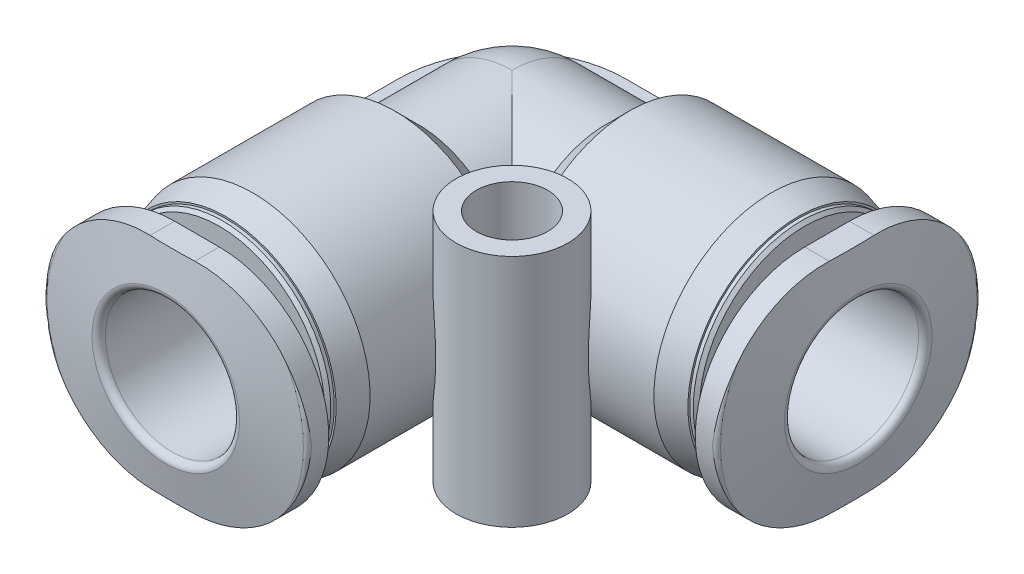
from build123d import *

# Parameters (mm, degrees)
SCHNITT_LINEAR_AUSTRAGEN1_DEPTH      = 1.4
AUFSATZ_LINEAR_START                 = 5.25
AUFSATZ_LINEAR_AUSTRAGEN1_DEPTH      = 5.25
AUFSATZ_LINEAR_AUSTRAGEN2_DEPTH      = 5.25
SCHNITT_LINEAR_AUSTRAGEN2_DEPTH      = 1.4
AUFSATZ_LINEAR_AUSTRAGEN3_DEPTH      = 5.25
AUFSATZ_LINEAR_AUSTRAGEN3_DEPTH_BACK = 5.25
SKIZZE9_R                            = 2.5
BOHRUNG1_D                           = 3.2
BOHRUNG1_DEPTH                       = 11.5
ROTATION3_ANGLE                      = 90


with BuildPart() as part:
    # Skizze1 → Rotation1 (revolve)
    with BuildSketch(Plane.XY):
        with BuildLine():
            Line((0, 4.2), (4.2, 4.2))
            Line((4.2, 4.2), (5.25, 5.25))
            Line((5.25, 5.25), (11.6, 5.25))
            Line((11.6, 5.25), (12.8, 4.928460969))
            Line((12.8, 4.928460969), (12.8, 4.848076211))
            Line((12.8, 4.848076211), (12.958578644, 4.848076211))
            Line((12.958578644, 4.848076211), (13.1, 4.706654855))
            Line((13.1, 4.706654855), (13.1, 3.7))
            Line((13.1, 3.7), (13.73, 3.7))
            ThreePointArc((13.73, 3.7), (13.991629509, 3.808370491), (14.1, 4.07))
            Line((14.1, 4.07), (14.1, 5.9))
            Line((14.1, 5.9), (14.873729924, 5.9))
            ThreePointArc((14.873729924, 5.9), (15.002287446, 5.853208889), (15.070691475, 5.734729636))
            Line((15.070691475, 5.734729636), (15.5, 3.3))
            Line((15.5, 3.3), (15.5, 0))
            Line((15.5, 0), (-4.2, 0))
            ThreePointArc((-4.2, 0), (-2.969848481, 2.969848481), (0, 4.2))
        make_face()
    revolve(axis=Axis((15.5, 0, 0), (-1, 0, 0)))

    # Skizze2 → Schnitt-Linear austragen1 (cut)
    with BuildSketch(Plane(origin=(15.5, 0, 0), x_dir=(0, 0, -1), z_dir=(1, 0, 0))):
        Polygon((-7.08, -4.087639906), (0, -8.175279812), (7.08, -4.087639906), (7.08, 4.087639906), (0, 8.175279812), (-7.08, 4.087639906), align=None)
        with BuildLine():
            Line((-1, -4.9), (1, -4.9))
            ThreePointArc((1, -4.9), (4.464823228, -3.464823228), (5.9, 0))
            ThreePointArc((5.9, 0), (4.464823228, 3.464823228), (1, 4.9))
            Line((1, 4.9), (-1, 4.9))
            ThreePointArc((-1, 4.9), (-4.464823228, 3.464823228), (-5.9, 0))
            ThreePointArc((-5.9, 0), (-4.464823228, -3.464823228), (-1, -4.9))
        make_face(mode=Mode.SUBTRACT)
    extrude(amount=-SCHNITT_LINEAR_AUSTRAGEN1_DEPTH, mode=Mode.SUBTRACT)

    # Skizze3 → Aufsatz-Linear austragen1 (add)
    with BuildSketch(Plane(origin=(0, 0, 0), x_dir=(0, 0, -1), z_dir=(1, 0, 0)).offset(AUFSATZ_LINEAR_START)):
        with BuildLine():
            Line((-5.077865912, -1.333333333), (5.077865912, -1.333333333))
            ThreePointArc((5.077865912, -1.333333333), (5.25, 0), (5.077865912, 1.333333333))
            Line((5.077865912, 1.333333333), (-5.077865912, 1.333333333))
            ThreePointArc((-5.077865912, 1.333333333), (-5.25, 0), (-5.077865912, -1.333333333))
        make_face()
    extrude(amount=-AUFSATZ_LINEAR_AUSTRAGEN1_DEPTH)

    # Skizze5 → Aufsatz-Linear austragen2 (add)
    with BuildSketch(Plane.XY):
        with BuildLine():
            Line((-5.077865912, -1.333333333), (0, -1.333333333))
            Line((0, -1.333333333), (0, 1.333333333))
            Line((0, 1.333333333), (-5.077865912, 1.333333333))
            ThreePointArc((-5.077865912, 1.333333333), (-5.25, 0), (-5.077865912, -1.333333333))
        make_face()
    extrude(amount=AUFSATZ_LINEAR_AUSTRAGEN2_DEPTH)

    # Skizze6 → Rotation2 (revolve)
    with BuildSketch(Plane(origin=(0, 0, 0), x_dir=(0, 0, -1), z_dir=(1, 0, 0))):
        with BuildLine():
            Line((0, 0), (0, -4.2))
            Line((0, -4.2), (-4.2, -4.2))
            Line((-4.2, -4.2), (-5.25, -5.25))
            Line((-5.25, -5.25), (-11.6, -5.25))
            Line((-11.6, -5.25), (-12.8, -4.928460969))
            Line((-12.8, -4.928460969), (-12.8, -4.848076211))
            Line((-12.8, -4.848076211), (-12.958578644, -4.848076211))
            Line((-12.958578644, -4.848076211), (-13.1, -4.706654855))
            Line((-13.1, -4.706654855), (-13.1, -3.7))
            Line((-13.1, -3.7), (-13.73, -3.7))
            ThreePointArc((-13.73, -3.7), (-13.991629509, -3.808370491), (-14.1, -4.07))
            Line((-14.1, -4.07), (-14.1, -5.9))
            Line((-14.1, -5.9), (-14.873729924, -5.9))
            ThreePointArc((-14.873729924, -5.9), (-15.002287446, -5.853208889), (-15.070691475, -5.734729636))
            Line((-15.070691475, -5.734729636), (-15.5, -3.3))
            Line((-15.5, -3.3), (-15.5, 0))
            Line((-15.5, 0), (0, 0))
        make_face()
    revolve(axis=Axis((0, 0, 15.5), (0, 0, -1)))

    # Skizze7 → Schnitt-Linear austragen2 (cut)
    with BuildSketch(Plane.XY.offset(15.5)):
        Polygon((-7.08, -4.087639906), (0, -8.175279812), (7.08, -4.087639906), (7.08, 4.087639906), (0, 8.175279812), (-7.08, 4.087639906), align=None)
        with BuildLine():
            Line((-1, -4.9), (1, -4.9))
            ThreePointArc((1, -4.9), (4.464823228, -3.464823228), (5.9, 0))
            ThreePointArc((5.9, 0), (4.464823228, 3.464823228), (1, 4.9))
            Line((1, 4.9), (-1, 4.9))
            ThreePointArc((-1, 4.9), (-4.464823228, 3.464823228), (-5.9, 0))
            ThreePointArc((-5.9, 0), (-4.464823228, -3.464823228), (-1, -4.9))
        make_face(mode=Mode.SUBTRACT)
    extrude(amount=-SCHNITT_LINEAR_AUSTRAGEN2_DEPTH, mode=Mode.SUBTRACT)

    # Skizze9 → Aufsatz-Linear austragen3 (add, two sides: drawn at the far end of the back side and taken through both)
    with BuildSketch(Plane(origin=(0, 0, 0), x_dir=(1, 0, 0), z_dir=(0, 1, 0)).offset(-AUFSATZ_LINEAR_AUSTRAGEN3_DEPTH_BACK)):
        with Locations((6.5, -6.5)):
            Circle(SKIZZE9_R)
    extrude(amount=AUFSATZ_LINEAR_AUSTRAGEN3_DEPTH + AUFSATZ_LINEAR_AUSTRAGEN3_DEPTH_BACK)

    # Bohrung1
    with Locations(Plane(origin=(0, 5.25, 0), x_dir=(1, 0, 0), z_dir=(0, 1, 0))):
        with Locations((6.5, -6.5)):
            Hole(BOHRUNG1_D / 2, depth=BOHRUNG1_DEPTH)

    # Skizze12 → Rotation3 (revolve)
    with BuildSketch(Plane(origin=(0, 0, 0), x_dir=(0, 0, -1), z_dir=(1, 0, 0))):
        with BuildLine():
            Line((0, 1.333333333), (5.077865912, 1.333333333))
            ThreePointArc((5.077865912, 1.333333333), (5.25, 0), (5.077865912, -1.333333333))
            Line((5.077865912, -1.333333333), (0, -1.333333333))
            Line((0, -1.333333333), (0, 1.333333333))
        make_face()
    revolve(axis=Axis((0, -1.333333333, 0), (0, 1, 0)), revolution_arc=ROTATION3_ANGLE)

    # Skizze8 → Schnitt-Rotation1 (revolve, cut)
    with BuildSketch(Plane(origin=(0, 0, 0), x_dir=(0, 0, -1), z_dir=(1, 0, 0))):
        with BuildLine():
            Line((0, 0), (0, -2))
            Line((0, -2), (-3.5, -2))
            Line((-3.5, -2), (-3.5, -2.8))
            ThreePointArc((-3.5, -2.8), (-3.558578644, -2.941421356), (-3.7, -3))
            Line((-3.7, -3), (-15.2, -3))
            ThreePointArc((-15.2, -3), (-15.412132034, -3.087867966), (-15.5, -3.3))
            Line((-15.5, -3.3), (-15.5, 0))
            Line((-15.5, 0), (0, 0))
        make_face()
    revolve(axis=Axis((0, 0, 15.5), (0, 0, -1)), mode=Mode.SUBTRACT)

    # Skizze4 → Schnitt-Rotation2 (revolve, cut)
    with BuildSketch(Plane(origin=(0, 0, 0), x_dir=(1, 0, 0), z_dir=(0, 1, 0))):
        with BuildLine():
            Line((0, 2), (3.5, 2))
            Line((3.5, 2), (3.5, 2.8))
            ThreePointArc((3.5, 2.8), (3.558578644, 2.941421356), (3.7, 3))
            Line((3.7, 3), (15.2, 3))
            ThreePointArc((15.2, 3), (15.412132034, 3.087867966), (15.5, 3.3))
            Line((15.5, 3.3), (15.5, 0))
            Line((15.5, 0), (-2, 0))
            ThreePointArc((-2, 0), (-1.414213562, 1.414213562), (0, 2))
        make_face()
    revolve(axis=Axis((15.5, 0, 0), (-1, 0, 0)), mode=Mode.SUBTRACT)


solid = part.part
